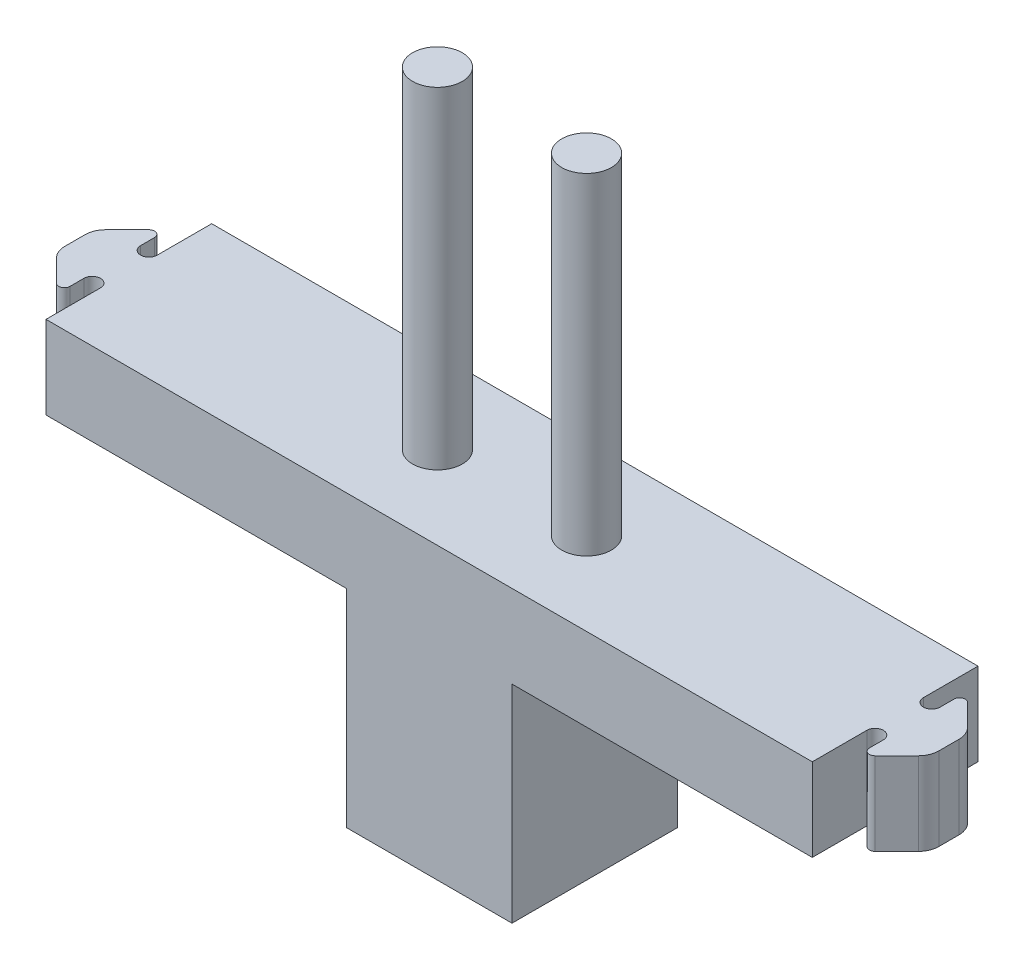
from build123d import *

# Parameters (mm, degrees)
SKETCH1_W           = 117.475
SKETCH1_H           = 25.4
BOSS_EXTRUDE1_DEPTH = 12.7
SKETCH3_R           = 3.81
BOSS_EXTRUDE2_DEPTH = 50.8
BOSS_EXTRUDE7_DEPTH = 12.7
SKETCH12_W          = 25.4
SKETCH12_H          = 25.4
BOSS_EXTRUDE8_DEPTH = 31.75


with BuildPart() as part:
    # Sketch1 → Boss-Extrude1 (new body)
    with BuildSketch(Plane(origin=(0, 0, 0), x_dir=(1, 0, 0), z_dir=(0, 1, 0))):
        with Locations((-58.7375, -12.7)):
            Rectangle(SKETCH1_W, SKETCH1_H)
    extrude(amount=BOSS_EXTRUDE1_DEPTH)

    # Sketch3 → Boss-Extrude2 (add)
    with BuildSketch(Plane(origin=(0, 12.7, 0), x_dir=(1, 0, 0), z_dir=(0, 1, 0))):
        with Locations(Location((-47.3075, -12.7, 0), (0, 0, 270))):
            Circle(SKETCH3_R)
        with Locations(Location((-70.1675, -12.7, 0), (0, 0, 90))):
            Circle(SKETCH3_R)
    extrude(amount=BOSS_EXTRUDE2_DEPTH)

    # Sketch10 → Boss-Extrude7 (add)
    with BuildSketch(Plane(origin=(0, 12.7, 0), x_dir=(1, 0, 0), z_dir=(0, 1, 0))):
        with BuildLine():
            Line((0, -12.7), (0, -8.3566))
            ThreePointArc((0, -8.3566), (1.27, -9.6266), (2.54, -8.3566))
            Line((2.54, -8.3566), (2.54, -6.223))
            ThreePointArc((2.54, -6.223), (3.073114588, -5.425137636), (4.014257416, -5.612342584))
            Line((4.014257416, -5.612342584), (7.336952181, -8.935037349))
            ThreePointArc((7.336952181, -8.935037349), (8.017998618, -9.969860776), (8.2511937, -11.186538149))
            Line((8.2511937, -11.186538149), (8.2511937, -12.7))
            Line((8.2511937, -12.7), (0, -12.7))
        make_face()
        with BuildLine():
            Line((-117.475, -12.7), (-117.475, -8.3566))
            ThreePointArc((-117.475, -8.3566), (-118.745, -9.6266), (-120.015, -8.3566))
            Line((-120.015, -8.3566), (-120.015, -6.223))
            ThreePointArc((-120.015, -6.223), (-120.548114588, -5.425137636), (-121.489257416, -5.612342584))
            Line((-121.489257416, -5.612342584), (-124.811952181, -8.935037349))
            ThreePointArc((-124.811952181, -8.935037349), (-125.492998618, -9.969860776), (-125.7261937, -11.186538149))
            Line((-125.7261937, -11.186538149), (-125.7261937, -12.7))
            Line((-125.7261937, -12.7), (-117.475, -12.7))
        make_face()
    boss_extrude7 = extrude(amount=-BOSS_EXTRUDE7_DEPTH)

    # Mirror1: Boss-Extrude7 across plane
    add(boss_extrude7.mirror(Plane(origin=(8.2511937, 0, 12.7), x_dir=(1, 0, 0), z_dir=(0, 0, 1))))

    # Sketch12 → Boss-Extrude8 (add)
    with BuildSketch(Plane(origin=(0, 0, 0), x_dir=(-1, 0, 0), z_dir=(0, -1, 0))):
        with Locations((58.7375, -12.7)):
            Rectangle(SKETCH12_W, SKETCH12_H)
    extrude(amount=BOSS_EXTRUDE8_DEPTH)


solid = part.part
